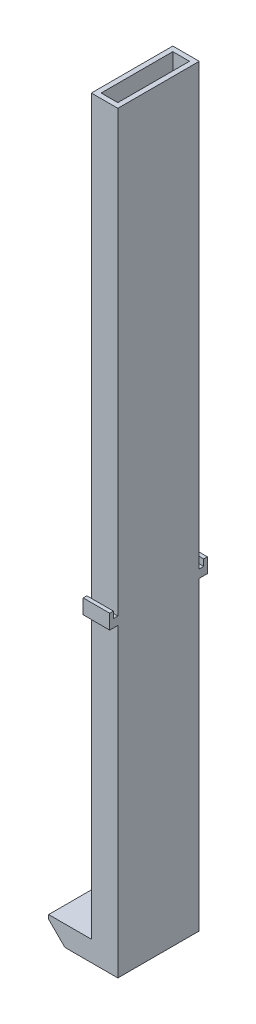
from build123d import *

# Parameters (mm, degrees)
SKETCH1_W           = 8.5
SKETCH1_H           = 92.5
BOSS_EXTRUDE1_DEPTH = 10
SKETCH2_W           = 5.25
SKETCH2_H           = 90
CUT_EXTRUDE3_DEPTH  = 80
CHAMFER1_SIZE       = 2
BOSS_EXTRUDE3_DEPTH = 3.25
SKETCH9_W           = 2.05
SKETCH9_H           = 8.8
CUT_EXTRUDE4_DEPTH  = 80


with BuildPart() as part:
    # Sketch1 → Boss-Extrude1 (new body)
    with BuildSketch(Plane.XY):
        Rectangle(SKETCH1_W, SKETCH1_H)
    extrude(amount=BOSS_EXTRUDE1_DEPTH)

    # Sketch2 → Cut-Extrude3 (cut)
    with BuildSketch(Plane.XY.offset(10)):
        with Locations((-1.625, 1.25)):
            Rectangle(SKETCH2_W, SKETCH2_H)
    extrude(amount=-CUT_EXTRUDE3_DEPTH, mode=Mode.SUBTRACT)

    # Chamfer1
    chamfer1_edges = [part.edges().sort_by_distance(p)[0] for p in [
        (-4.25, -46.25, 5),
    ]]
    chamfer(chamfer1_edges, length=CHAMFER1_SIZE)

    # Sketch7 → Boss-Extrude3 (add)
    with BuildSketch(Plane.ZY.offset(-1)):
        Polygon((10, -8.75), (11, -8.75), (11, -6.95), (10.55, -6.95), (10.55, -7.75), (10, -7.75), align=None)
    boss_extrude3 = extrude(amount=-BOSS_EXTRUDE3_DEPTH)

    # Mirror2: Boss-Extrude3 across plane
    add(boss_extrude3.mirror(Plane.XY.offset(5)))

    # Sketch9 → Cut-Extrude4 (cut)
    with BuildSketch(Plane(origin=(0, 46.25, 0), x_dir=(1, 0, 0), z_dir=(0, 1, 0))):
        with Locations((2.625, -5)):
            Rectangle(SKETCH9_W, SKETCH9_H)
    extrude(amount=-CUT_EXTRUDE4_DEPTH, mode=Mode.SUBTRACT)


solid = part.part
